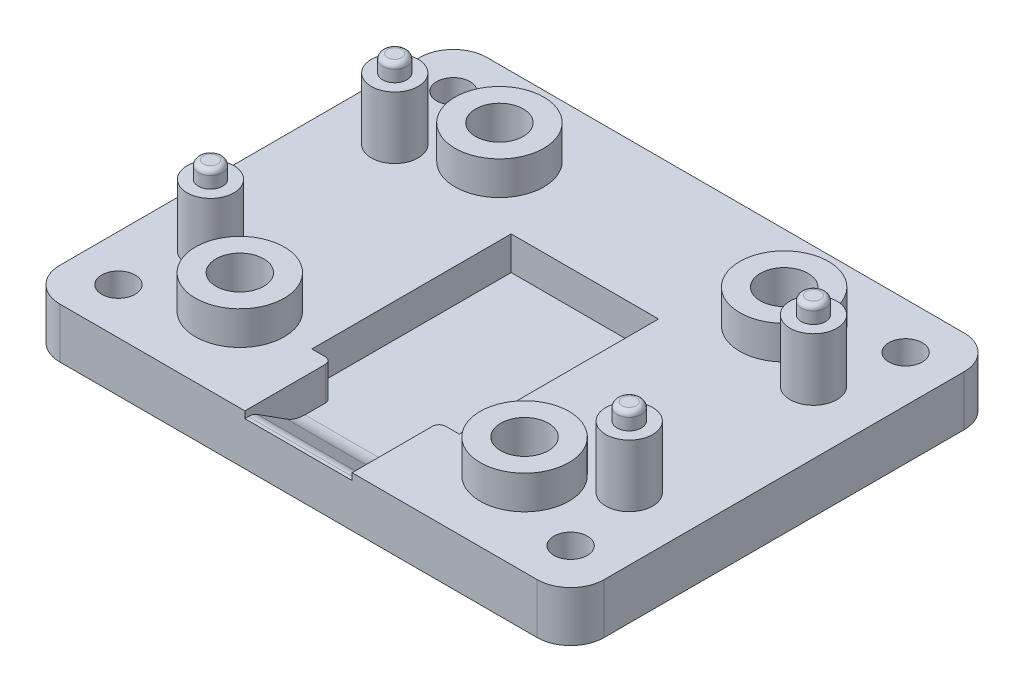
from build123d import *

# Parameters (mm, degrees)
SKETCH_1_W          = 32.5
SKETCH_1_H          = 25.5
EXTRUDE_1_DEPTH     = 3
EXTRUDE_2_DEPTH     = 1.5
SKETCH_5_R          = 1.4
EXTRUDE_3_DEPTH     = 3.7
SKETCH_6_R          = 0.725
EXTRUDE_4_DEPTH     = 1
SKETCH_7_R          = 1
CUT_EXTRUDE_1_DEPTH = 10
SKETCH_8_R          = 2
CUT_EXTRUDE_2_DEPTH = 1
FILLET_1_R          = 2
SKETCH_9_R          = 2.65
EXTRUDE_5_DEPTH     = 2
SKETCH_11_R         = 1.05
CUT_EXTRUDE_4_DEPTH = 100
SKETCH_12_R         = 1.425
CUT_EXTRUDE_5_DEPTH = 4
FILLET_2_R          = 0.3
CUT_EXTRUDE_8_DEPTH = 2
CUT_EXTRUDE_9_DEPTH = 1.5
EXTRUDE_6_DEPTH     = 6.4
FILLET_3_R          = 2
FILLET_5_R          = 1
FILLET_6_R          = 0.4


with BuildPart() as part:
    # 草图1 → 凸台-拉伸1 (new body)
    with BuildSketch(Plane(origin=(0, 0, 0), x_dir=(1, 0, 0), z_dir=(0, 1, 0))):
        Rectangle(SKETCH_1_W, SKETCH_1_H)
    extrude(amount=EXTRUDE_1_DEPTH)

    # 草图2 → 凸台-拉伸2 (add)
    with BuildSketch(Plane(origin=(0, 3, 0), x_dir=(1, 0, 0), z_dir=(0, 1, 0))):
        Polygon((-5.4, 5.35), (5.4, 5.35), (5.4, -7.55), (4.4, -7.55), (4.4, 4.35), (-4.4, 4.35), (-4.4, -7.55), (-5.4, -7.55), align=None)
    extrude(amount=EXTRUDE_2_DEPTH)

    # 草图5 → 凸台-拉伸3 (add)
    with BuildSketch(Plane(origin=(0, 3, 0), x_dir=(1, 0, 0), z_dir=(0, 1, 0))):
        with Locations(Location((12.5, 5.5, 0), (0, 0, 270))):
            Circle(SKETCH_5_R)
        with Locations(Location((12.5, -5.5, 0), (0, 0, 90))):
            Circle(SKETCH_5_R)
        with Locations(Location((-12.5, -5.5, 0), (0, 0, 270))):
            Circle(SKETCH_5_R)
        with Locations(Location((-12.5, 5.5, 0), (0, 0, 90))):
            Circle(SKETCH_5_R)
    extrude(amount=EXTRUDE_3_DEPTH)

    # 草图6 → 凸台-拉伸4 (add)
    with BuildSketch(Plane(origin=(0, 6.7, 0), x_dir=(1, 0, 0), z_dir=(0, 1, 0))):
        with Locations(Location((-12.5, -5.5, 0), (0, 0, 270))):
            Circle(SKETCH_6_R)
        with Locations(Location((-12.5, 5.5, 0), (0, 0, 270))):
            Circle(SKETCH_6_R)
        with Locations(Location((12.5, 5.5, 0), (0, 0, 270))):
            Circle(SKETCH_6_R)
        with Locations(Location((12.5, -5.5, 0), (0, 0, 270))):
            Circle(SKETCH_6_R)
    extrude(amount=EXTRUDE_4_DEPTH)

    # 草图7 → 切除-拉伸1 (cut)
    with BuildSketch(Plane(origin=(0, 3, 0), x_dir=(1, 0, 0), z_dir=(0, 1, 0))):
        with Locations(Location((13.5, 10, 0), (0, 0, 270))):
            Circle(SKETCH_7_R)
        with Locations(Location((-13.5, 10, 0), (0, 0, 270))):
            Circle(SKETCH_7_R)
        with Locations(Location((-13.5, -10, 0), (0, 0, 270))):
            Circle(SKETCH_7_R)
        with Locations(Location((13.5, -10, 0), (0, 0, 270))):
            Circle(SKETCH_7_R)
    extrude(amount=-CUT_EXTRUDE_1_DEPTH, mode=Mode.SUBTRACT)

    # 草图8 → 切除-拉伸2 (cut)
    with BuildSketch(Plane.XZ):
        with Locations(Location((-13.5, 10, 0), (0, 0, 270))):
            Circle(SKETCH_8_R)
        with Locations(Location((13.5, 10, 0), (0, 0, 270))):
            Circle(SKETCH_8_R)
        with Locations(Location((13.5, -10, 0), (0, 0, 270))):
            Circle(SKETCH_8_R)
        with Locations(Location((-13.5, -10, 0), (0, 0, 270))):
            Circle(SKETCH_8_R)
    extrude(amount=-CUT_EXTRUDE_2_DEPTH, mode=Mode.SUBTRACT)

    # 圆角1
    fillet_1_edges = [part.edges().sort_by_distance(p)[0] for p in [
        (16.25, 1.5, 12.75),
        (-16.25, 1.5, 12.75),
        (-16.25, 1.5, -12.75),
        (16.25, 1.5, -12.75),
    ]]
    fillet(fillet_1_edges, radius=FILLET_1_R)

    # 草图9 → 凸台-拉伸5 (add)
    with BuildSketch(Plane(origin=(0, 3, 0), x_dir=(1, 0, 0), z_dir=(0, 1, 0))):
        with Locations(Location((8.5, 7.75, 0), (0, 0, 270))):
            Circle(SKETCH_9_R)
        with Locations(Location((-8.5, 7.75, 0), (0, 0, 90))):
            Circle(SKETCH_9_R)
        with Locations(Location((-8.5, -7.75, 0), (0, 0, 270))):
            Circle(SKETCH_9_R)
        with Locations(Location((8.5, -7.75, 0), (0, 0, 90))):
            Circle(SKETCH_9_R)
    extrude(amount=EXTRUDE_5_DEPTH)

    # 草图11 → 切除-拉伸4 (cut)
    with BuildSketch(Plane(origin=(0, 5, 0), x_dir=(1, 0, 0), z_dir=(0, 1, 0))):
        with Locations(Location((-8.5, 7.75, 0), (0, 0, 270))):
            Circle(SKETCH_11_R)
        with Locations(Location((-8.5, -7.75, 0), (0, 0, 270))):
            Circle(SKETCH_11_R)
        with Locations(Location((8.5, -7.75, 0), (0, 0, 270))):
            Circle(SKETCH_11_R)
        with Locations(Location((8.5, 7.75, 0), (0, 0, 270))):
            Circle(SKETCH_11_R)
    extrude(amount=-CUT_EXTRUDE_4_DEPTH, mode=Mode.SUBTRACT)

    # 草图12 → 切除-拉伸5 (cut)
    with BuildSketch(Plane(origin=(0, 5, 0), x_dir=(1, 0, 0), z_dir=(0, 1, 0))):
        with Locations(Location((-8.5, 7.75, 0), (0, 0, 270))):
            Circle(SKETCH_12_R)
        with Locations(Location((8.5, 7.75, 0), (0, 0, 270))):
            Circle(SKETCH_12_R)
        with Locations(Location((-8.5, -7.75, 0), (0, 0, 270))):
            Circle(SKETCH_12_R)
        with Locations(Location((8.5, -7.75, 0), (0, 0, 270))):
            Circle(SKETCH_12_R)
    extrude(amount=-CUT_EXTRUDE_5_DEPTH, mode=Mode.SUBTRACT)

    # 圆角2
    fillet_2_edges = [part.edges().sort_by_distance(p)[0] for p in [
        (-12.5, 7.7, 4.775),
        (-12.5, 7.7, -6.225),
        (12.5, 7.7, -6.225),
        (12.5, 7.7, 4.775),
    ]]
    fillet(fillet_2_edges, radius=FILLET_2_R)

    # 草图15 → 切除-拉伸8 (cut)
    with BuildSketch(Plane(origin=(0, 3, 0), x_dir=(1, 0, 0), z_dir=(0, 1, 0))):
        Polygon((-4.4, 4.35), (4.4, 4.35), (4.4, -7.55), (3.2, -7.55), (3.2, -12.75), (-3.2, -12.75), (-3.2, -7.55), (-4.4, -7.55), align=None)
    extrude(amount=-CUT_EXTRUDE_8_DEPTH, mode=Mode.SUBTRACT)

    # 草图17 → 切除-拉伸9 (cut)
    with BuildSketch(Plane(origin=(0, 4.5, 0), x_dir=(1, 0, 0), z_dir=(0, 1, 0))):
        Polygon((-4.4, -7.55), (-4.4, 4.35), (4.4, 4.35), (4.4, -7.55), (5.4, -7.55), (5.4, 5.35), (-5.4, 5.35), (-5.4, -7.55), align=None)
    extrude(amount=-CUT_EXTRUDE_9_DEPTH, mode=Mode.SUBTRACT)

    # 草图18 → 凸台-拉伸6 (add)
    with BuildSketch(Plane.ZY.offset(-3.2)):
        Polygon((12.75, 1), (9.75, 1), (12.25, 2.6), (12.75, 2.6), align=None)
    extrude(amount=EXTRUDE_6_DEPTH)

    # 圆角3
    fillet_3_edges = [part.edges().sort_by_distance(p)[0] for p in [
        (0, 1, 9.75),
    ]]
    fillet(fillet_3_edges, radius=FILLET_3_R)

    # 圆角5
    fillet_5_edges = [part.edges().sort_by_distance(p)[0] for p in [
        (0, 2.6, 12.25),
    ]]
    fillet(fillet_5_edges, radius=FILLET_5_R)

    # 圆角6
    fillet_6_edges = [part.edges().sort_by_distance(p)[0] for p in [
        (3.2, 2, 7.55),
        (-3.2, 2, 7.55),
    ]]
    fillet(fillet_6_edges, radius=FILLET_6_R)


solid = part.part
